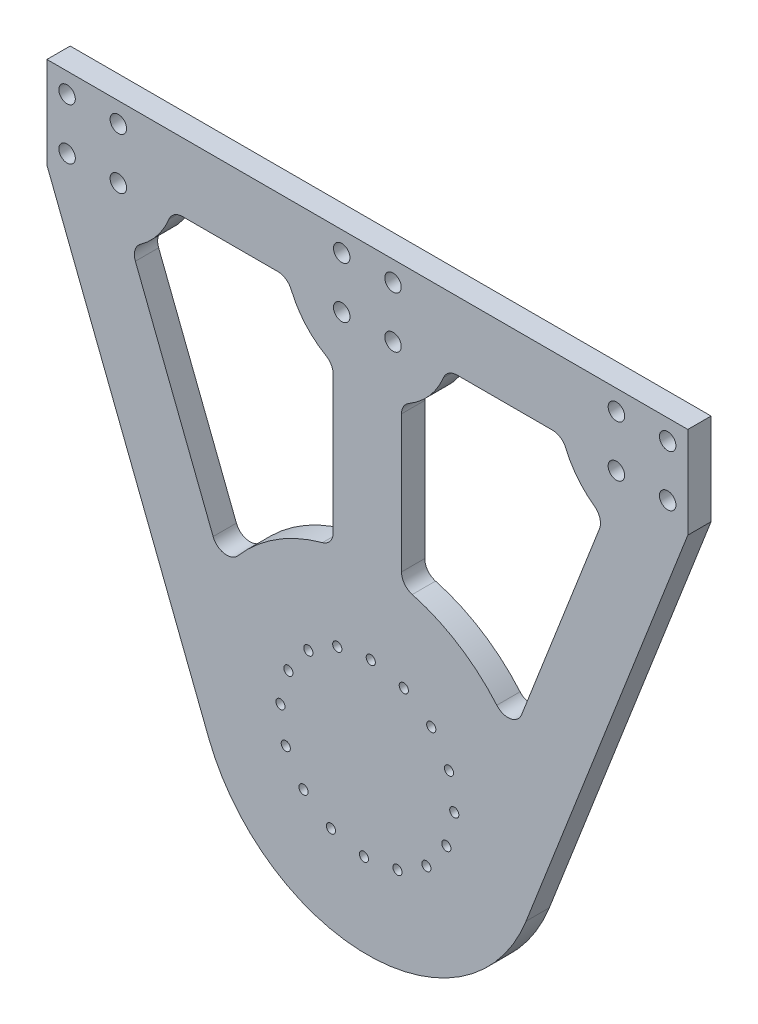
from build123d import *

# Parameters (mm, degrees)
BOSS_EXTRUDE1_DEPTH     = 3.175
CUT_EXTRUDE2_DEPTH      = 150.86267881
CUT_EXTRUDE2_DEPTH_BACK = 150.86267881
SKETCH3_R               = 1.25
CUT_EXTRUDE6_DEPTH      = 150.86267881
CUT_EXTRUDE6_DEPTH_BACK = 150.86267881
SKETCH12_R              = 2.25
CUT_EXTRUDE7_DEPTH      = 150.86267881
CUT_EXTRUDE7_DEPTH_BACK = 150.86267881
FILLET4_R               = 4


with BuildPart() as part:
    # Sketch1 → Boss-Extrude1 (new, symmetric)
    with BuildSketch(Plane.XY):
        with BuildLine():
            Line((87.5, 121.5), (-87.5, 121.5))
            Line((-87.5, 121.5), (-87.5, 96.5))
            Line((-87.5, 96.5), (-43.327910637, -16.880229852))
            ThreePointArc((-43.327910637, -16.880229852), (0, -46.5), (43.327910637, -16.880229852))
            Line((43.327910637, -16.880229852), (87.5, 96.5))
            Line((87.5, 96.5), (87.5, 121.5))
        make_face()
    extrude(amount=BOSS_EXTRUDE1_DEPTH, both=True)

    # Sketch3 → Cut-Extrude2 (cut, two sides: drawn at the far end of the back side and taken through both)
    with BuildSketch(Plane(origin=(0, 0, -3.175), x_dir=(-1, 0, 0), z_dir=(0, 0, -1)).offset(-CUT_EXTRUDE2_DEPTH_BACK)):
        with Locations((17.440159599, -16.121517706)):
            Circle(SKETCH3_R)
        with Locations((22.282044228, -8.220280106)):
            Circle(SKETCH3_R)
        with Locations((9.943168767, -21.568400378)):
            Circle(SKETCH3_R)
        with Locations((0.932420624, -23.731689611)):
            Circle(SKETCH3_R)
        with Locations((-8.220280106, -22.282044228)):
            Circle(SKETCH3_R)
        with Locations((-16.121517706, -17.440159599)):
            Circle(SKETCH3_R)
        with Locations((-21.568400378, -9.943168767)):
            Circle(SKETCH3_R)
        with Locations((-23.731689611, -0.932420624)):
            Circle(SKETCH3_R)
        with Locations((-22.282044228, 8.220280106)):
            Circle(SKETCH3_R)
        with Locations((-17.440159599, 16.121517706)):
            Circle(SKETCH3_R)
        with Locations((-9.943168767, 21.568400378)):
            Circle(SKETCH3_R)
        with Locations((-0.932420624, 23.731689611)):
            Circle(SKETCH3_R)
        with Locations((8.220280106, 22.282044228)):
            Circle(SKETCH3_R)
        with Locations((16.121517706, 17.440159599)):
            Circle(SKETCH3_R)
        with Locations((21.568400378, 9.943168767)):
            Circle(SKETCH3_R)
        with Locations((23.731689611, 0.932420624)):
            Circle(SKETCH3_R)
    extrude(amount=CUT_EXTRUDE2_DEPTH + CUT_EXTRUDE2_DEPTH_BACK, mode=Mode.SUBTRACT)

    # Sketch12 → Cut-Extrude6 (cut, two sides: drawn at the far end of the back side and taken through both)
    with BuildSketch(Plane(origin=(0, 0, -3.175), x_dir=(-1, 0, 0), z_dir=(0, 0, -1)).offset(-CUT_EXTRUDE6_DEPTH_BACK)):
        with Locations((-7, 102)):
            Circle(SKETCH12_R)
        with Locations((7, 102)):
            Circle(SKETCH12_R)
        with Locations((7, 116)):
            Circle(SKETCH12_R)
        with Locations((-82, 116)):
            Circle(SKETCH12_R)
        with Locations((-68, 116)):
            Circle(SKETCH12_R)
        with Locations((-68, 102)):
            Circle(SKETCH12_R)
        with Locations((-82, 102)):
            Circle(SKETCH12_R)
        with Locations(Location((82, 102, 0), (0, 0, 180))):
            Circle(SKETCH12_R)
        with Locations(Location((68, 102, 0), (0, 0, 180))):
            Circle(SKETCH12_R)
        with Locations(Location((68, 116, 0), (0, 0, 180))):
            Circle(SKETCH12_R)
        with Locations(Location((82, 116, 0), (0, 0, 180))):
            Circle(SKETCH12_R)
        with Locations((-7, 116)):
            Circle(SKETCH12_R)
    extrude(amount=CUT_EXTRUDE6_DEPTH + CUT_EXTRUDE6_DEPTH_BACK, mode=Mode.SUBTRACT)

    # Sketch13 → Cut-Extrude7 (cut, two sides: drawn at the far end of the back side and taken through both)
    with BuildSketch(Plane(origin=(0, 0, -3.175), x_dir=(-1, 0, 0), z_dir=(0, 0, -1)).offset(-CUT_EXTRUDE7_DEPTH_BACK)):
        with BuildLine():
            Line((-39.473357495, 24.578528192), (-64.591776998, 89.0520955))
            ThreePointArc((-64.591776998, 89.0520955), (-57.549704921, 94.796577819), (-53.354481954, 102.85821292))
            Line((-53.354481954, 102.85821292), (-21.645518046, 102.85821292))
            ThreePointArc((-21.645518046, 102.85821292), (-17.06210253, 94.332530646), (-9.32089354, 88.521451623))
            Line((-9.32089354, 88.521451623), (-9.32089354, 45.556239349))
            ThreePointArc((-9.32089354, 45.556239349), (-26.556276563, 38.170855048), (-39.473357495, 24.578528192))
        make_face()
        with BuildLine():
            Line((39.473357495, 24.578528192), (64.555315361, 88.958506339))
            ThreePointArc((64.555315361, 88.958506339), (57.499891336, 94.745342648), (53.322832732, 102.85821292))
            Line((53.322832732, 102.85821292), (21.645518046, 102.85821292))
            ThreePointArc((21.645518046, 102.85821292), (17.06210253, 94.332530646), (9.32089354, 88.521451623))
            Line((9.32089354, 88.521451623), (9.32089354, 45.556239349))
            ThreePointArc((9.32089354, 45.556239349), (26.556276563, 38.170855048), (39.473357495, 24.578528192))
        make_face()
    extrude(amount=CUT_EXTRUDE7_DEPTH + CUT_EXTRUDE7_DEPTH_BACK, mode=Mode.SUBTRACT)

    # Fillet4
    fillet4_edges = [part.edges().sort_by_distance(p)[0] for p in [
        (-53.322832732, 102.85821292, 0),
        (-64.555315361, 88.958506339, 0),
        (-39.473357495, 24.578528192, 0),
        (-9.32089354, 45.556239349, 0),
        (-9.32089354, 88.521451623, 0),
        (-21.645518046, 102.85821292, 0),
        (64.591776998, 89.0520955, 0),
        (53.354481954, 102.85821292, 0),
        (21.645518046, 102.85821292, 0),
        (9.32089354, 88.521451623, 0),
        (9.32089354, 45.556239349, 0),
        (39.473357495, 24.578528192, 0),
    ]]
    fillet(fillet4_edges, radius=FILLET4_R)


solid = part.part
